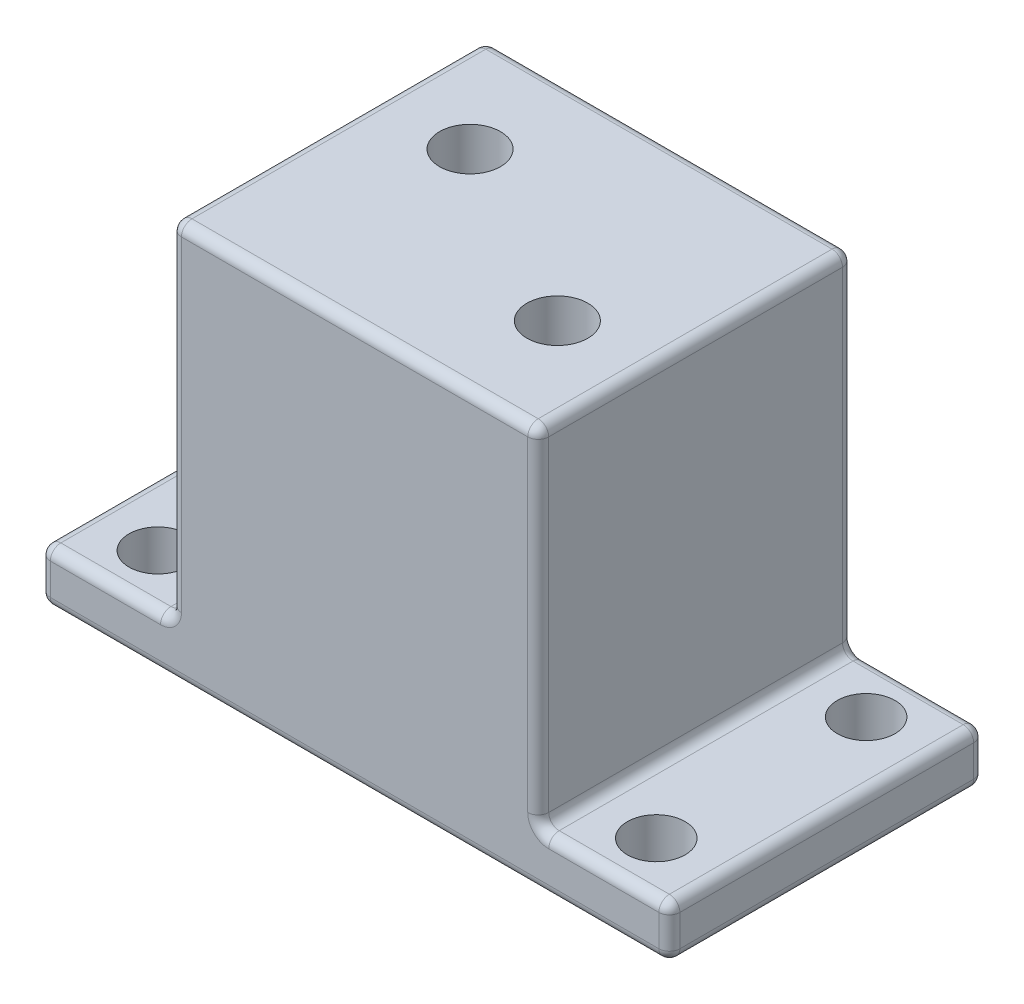
from build123d import *

# Parameters (mm, degrees)
SKETCH2_W           = 60
SKETCH2_H           = 30
BOSS_EXTRUDE1_DEPTH = 5
SKETCH3_W           = 35
SKETCH3_H           = 30
BOSS_EXTRUDE2_DEPTH = 33
SKETCH5_R           = 2.9
CUT_EXTRUDE1_DEPTH  = 20
SKETCH6_R           = 2.75
CUT_EXTRUDE2_DEPTH  = 75.759614766
FILLET1_R           = 1


with BuildPart() as part:
    # Sketch2 → Boss-Extrude1 (new body)
    with BuildSketch(Plane(origin=(0, 0, 0), x_dir=(1, 0, 0), z_dir=(0, 1, 0))):
        with Locations((30, -15)):
            Rectangle(SKETCH2_W, SKETCH2_H)
    extrude(amount=BOSS_EXTRUDE1_DEPTH)

    # Sketch3 → Boss-Extrude2 (add)
    with BuildSketch(Plane(origin=(0, 5, 0), x_dir=(1, 0, 0), z_dir=(0, 1, 0))):
        with Locations((30, -15)):
            Rectangle(SKETCH3_W, SKETCH3_H)
    extrude(amount=BOSS_EXTRUDE2_DEPTH)

    # Sketch5 → Cut-Extrude1 (cut)
    with BuildSketch(Plane(origin=(0, 38, 0), x_dir=(1, 0, 0), z_dir=(0, 1, 0))):
        with Locations(Location((21, -10, 0), (0, 0, 270))):
            Circle(SKETCH5_R)
        with Locations(Location((39.325, -20, 0), (0, 0, 270))):
            Circle(SKETCH5_R)
    extrude(amount=-CUT_EXTRUDE1_DEPTH, mode=Mode.SUBTRACT)

    # Sketch6 → Cut-Extrude2 (cut, through all)
    with BuildSketch(Plane(origin=(0, 5, 0), x_dir=(1, 0, 0), z_dir=(0, 1, 0))):
        with Locations(Location((53.75, -5, 0), (0, 0, 270))):
            Circle(SKETCH6_R)
        with Locations(Location((53.75, -25, 0), (0, 0, 270))):
            Circle(SKETCH6_R)
        with Locations(Location((6.25, -25, 0), (0, 0, 270))):
            Circle(SKETCH6_R)
        with Locations(Location((6.25, -5, 0), (0, 0, 270))):
            Circle(SKETCH6_R)
    extrude(amount=-CUT_EXTRUDE2_DEPTH, mode=Mode.SUBTRACT)

    # Fillet1
    fillet1_edges = [part.edges().sort_by_distance(p)[0] for p in [
        (0, 5, 15),
        (6.25, 5, 0),
        (53.75, 5, 30),
        (6.25, 5, 30),
        (47.5, 5, 15),
        (47.5, 21.5, 30),
        (47.5, 21.5, 0),
        (12.5, 5, 15),
        (12.5, 21.5, 0),
        (12.5, 21.5, 30),
        (47.5, 38, 15),
        (30, 38, 0),
        (12.5, 38, 15),
        (30, 38, 30),
        (60, 5, 15),
        (30, 0, 30),
        (0, 0, 15),
        (30, 0, 0),
        (60, 0, 15),
        (60, 2.5, 30),
        (0, 2.5, 30),
        (0, 2.5, 0),
        (60, 2.5, 0),
        (53.75, 5, 0),
    ]]
    fillet(fillet1_edges, radius=FILLET1_R)


solid = part.part
